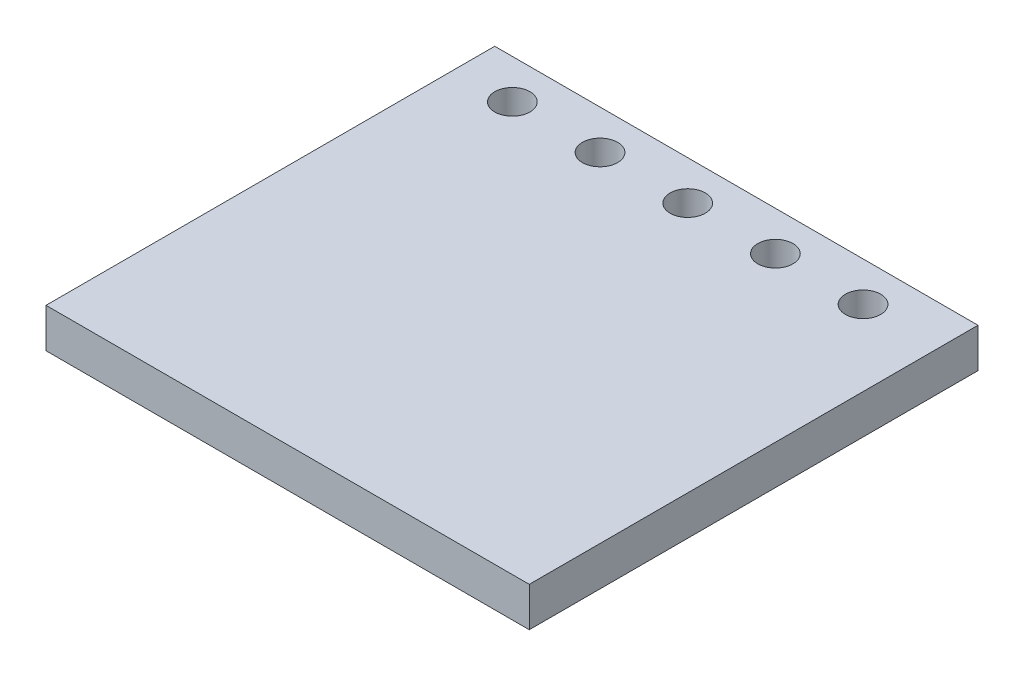
from build123d import *

# Parameters (mm, degrees)
SKETCH1_W           = 14
SKETCH1_H           = 13
SKETCH1_R           = 0.51
BOSS_EXTRUDE1_DEPTH = 1.14


with BuildPart() as part:
    # Sketch1 → Boss-Extrude1 (new body)
    with BuildSketch(Plane(origin=(0, 0, 0), x_dir=(1, 0, 0), z_dir=(0, 1, 0))):
        with Locations((7, -6.5)):
            Rectangle(SKETCH1_W, SKETCH1_H)
        with Locations(Location((1.65, -1.14, 0), (0, 0, 270))):
            Circle(SKETCH1_R, mode=Mode.SUBTRACT)
        with Locations(Location((4.19, -1.14, 0), (0, 0, 270))):
            Circle(SKETCH1_R, mode=Mode.SUBTRACT)
        with Locations(Location((6.73, -1.14, 0), (0, 0, 270))):
            Circle(SKETCH1_R, mode=Mode.SUBTRACT)
        with Locations(Location((9.27, -1.14, 0), (0, 0, 270))):
            Circle(SKETCH1_R, mode=Mode.SUBTRACT)
        with Locations(Location((11.81, -1.14, 0), (0, 0, 270))):
            Circle(SKETCH1_R, mode=Mode.SUBTRACT)
    extrude(amount=BOSS_EXTRUDE1_DEPTH)


solid = part.part
